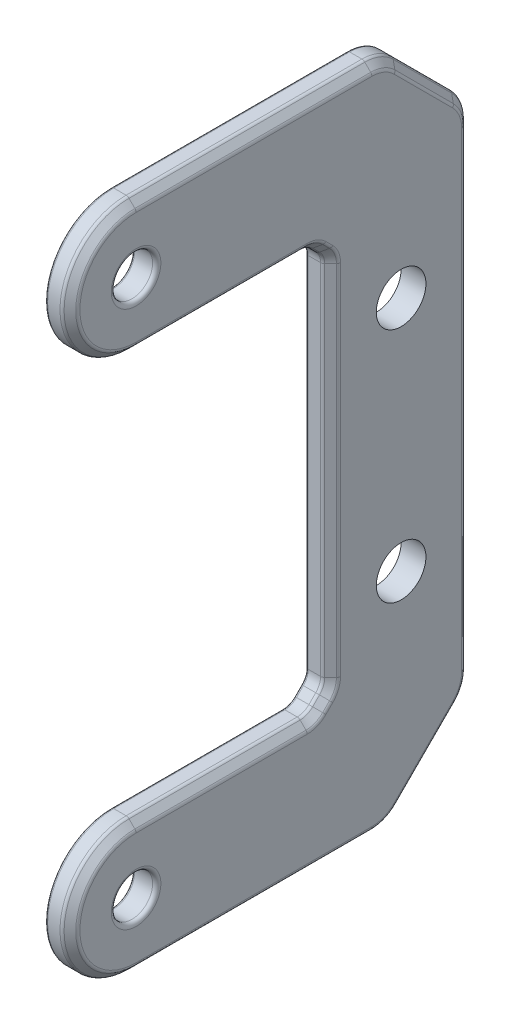
from build123d import *

# Parameters (mm, degrees)
SKETCH1_R           = 2.5
BOSS_EXTRUDE1_DEPTH = 3
FILLET4_R           = 5
FILLET5_R           = 2
FILLET6_R           = 0.3
CHAMFER4_SIZE       = 1
FILLET7_R           = 0.5
FILLET9_R           = 0.5
SKETCH2_R           = 3
CUT_EXTRUDE1_DEPTH  = 10


with BuildPart() as part:
    # Sketch1 → Boss-Extrude1 (new body)
    with BuildSketch(Plane(origin=(0, 0, 0), x_dir=(0, 0, -1), z_dir=(1, 0, 0))):
        with BuildLine():
            Line((40.59, -2), (30.59, 8))
            Line((30.59, 8), (0, 8))
            ThreePointArc((0, 8), (-8, 0), (0, -8))
            Line((0, -8), (21.522707061, -8))
            Line((21.522707061, -8), (23.522707061, -10))
            Line((23.522707061, -10), (23.522707061, -55))
            Line((23.522707061, -55), (21.522707061, -57))
            Line((21.522707061, -57), (0, -57))
            ThreePointArc((0, -57), (-8, -65), (0, -73))
            Line((0, -73), (30.59, -73))
            Line((30.59, -73), (40.59, -63))
            Line((40.59, -63), (40.59, -2))
        make_face()
        Circle(SKETCH1_R, mode=Mode.SUBTRACT)
        with Locations(Location((0, -65, 0), (0, 0, 180))):
            Circle(SKETCH1_R, mode=Mode.SUBTRACT)
    extrude(amount=BOSS_EXTRUDE1_DEPTH)

    # Fillet4
    fillet4_edges = [part.edges().sort_by_distance(p)[0] for p in [
        (1.5, 8, -30.59),
        (1.5, -2, -40.59),
        (1.5, -63, -40.59),
        (1.5, -73, -30.59),
    ]]
    fillet(fillet4_edges, radius=FILLET4_R)

    # Fillet5
    fillet5_edges = [part.edges().sort_by_distance(p)[0] for p in [
        (1.5, -57, -21.522707061),
        (1.5, -55, -23.522707061),
        (1.5, -10, -23.522707061),
        (1.5, -8, -21.522707061),
    ]]
    fillet(fillet5_edges, radius=FILLET5_R)

    # Fillet6
    fillet6_edges = [part.edges().sort_by_distance(p)[0] for p in [
        (0, -56.847759065, -21.459646801),
        (0, -54.93693974, -23.370466126),
        (0, -8, -10.347139968),
        (0, 0, 8),
        (0, 8, -14.259466094),
        (0, -73, -14.259466094),
        (0, -65, 8),
        (0, -57, -10.347139968),
        (0, 0, 2.5),
        (0, -65, -2.5),
        (0, -68, -35.59),
        (0, 3, -35.59),
        (0, -32.5, -40.59),
        (0, -2.15765065, -40.209397663),
        (0, 7.619397663, -30.43234935),
        (0, -62.84234935, -40.209397663),
        (0, -72.619397663, -30.43234935),
        (0, -32.5, -23.522707061),
        (0, -9, -22.522707061),
        (0, -56, -22.522707061),
        (0, -10.06306026, -23.370466126),
        (0, -8.152240935, -21.459646801),
    ]]
    fillet(fillet6_edges, radius=FILLET6_R)

    # Chamfer4
    chamfer4_edges = [part.edges().sort_by_distance(p)[0] for p in [
        (3, -56.847759065, -21.459646801),
        (3, -54.93693974, -23.370466126),
        (3, -65, 8),
        (3, -73, -14.259466094),
        (3, 8, -14.259466094),
        (3, 0, 8),
        (3, -8, -10.347139968),
        (3, -68, -35.59),
        (3, -32.5, -40.59),
        (3, 3, -35.59),
        (3, -2.15765065, -40.209397663),
        (3, 7.619397663, -30.43234935),
        (3, -62.84234935, -40.209397663),
        (3, -72.619397663, -30.43234935),
        (3, -57, -10.347139968),
        (3, -32.5, -23.522707061),
        (3, -9, -22.522707061),
        (3, -56, -22.522707061),
        (3, -10.06306026, -23.370466126),
        (3, -8.152240935, -21.459646801),
    ]]
    chamfer(chamfer4_edges, length=CHAMFER4_SIZE)

    # Fillet7
    fillet7_edges = [part.edges().sort_by_distance(p)[0] for p in [
        (3, -7, -10.347139968),
        (3, -7.228361402, -21.842330233),
        (3, 0, 7),
        (3, -8.292893219, -23.229813842),
        (3, 7, -14.259466094),
        (3, -9.680376828, -24.294345658),
        (3, 6.69551813, -30.049665918),
        (3, -32.5, -24.522707061),
        (3, 2.292893219, -34.882893219),
        (3, -55.319623172, -24.294345658),
        (3, -2.540334082, -39.28551813),
        (3, -56.707106781, -23.229813842),
        (3, -32.5, -39.59),
        (3, -57.771638598, -21.842330233),
        (3, -62.459665918, -39.28551813),
        (3, -58, -10.347139968),
        (3, -67.292893219, -34.882893219),
        (3, -65, 7),
        (3, -71.69551813, -30.049665918),
        (3, -72, -14.259466094),
        (2, -73, -14.259466094),
        (2, -72.619397663, -30.43234935),
        (2, -65, 8),
        (2, -68, -35.59),
        (2, -57, -10.347139968),
        (2, -62.84234935, -40.209397663),
        (2, -56.847759065, -21.459646801),
        (2, -32.5, -40.59),
        (2, -56, -22.522707061),
        (2, -2.15765065, -40.209397663),
        (2, -54.93693974, -23.370466126),
        (2, 3, -35.59),
        (2, -32.5, -23.522707061),
        (2, 7.619397663, -30.43234935),
        (2, -10.06306026, -23.370466126),
        (2, 8, -14.259466094),
        (2, -9, -22.522707061),
        (2, 0, 8),
        (2, -8.152240935, -21.459646801),
        (2, -8, -10.347139968),
    ]]
    fillet(fillet7_edges, radius=FILLET7_R)

    # Fillet9
    fillet9_edges = [part.edges().sort_by_distance(p)[0] for p in [
        (3, 0, 2.5),
        (3, -65, -2.5),
    ]]
    fillet(fillet9_edges, radius=FILLET9_R)

    # Sketch2 → Cut-Extrude1 (cut)
    with BuildSketch(Plane(origin=(3, 0, 0), x_dir=(0, 0, -1), z_dir=(1, 0, 0))):
        with Locations((32.05635353, -18.18914451)):
            Circle(SKETCH2_R)
        with Locations((32.05635353, -46.81085549)):
            Circle(SKETCH2_R)
    extrude(amount=-CUT_EXTRUDE1_DEPTH, mode=Mode.SUBTRACT)


solid = part.part
